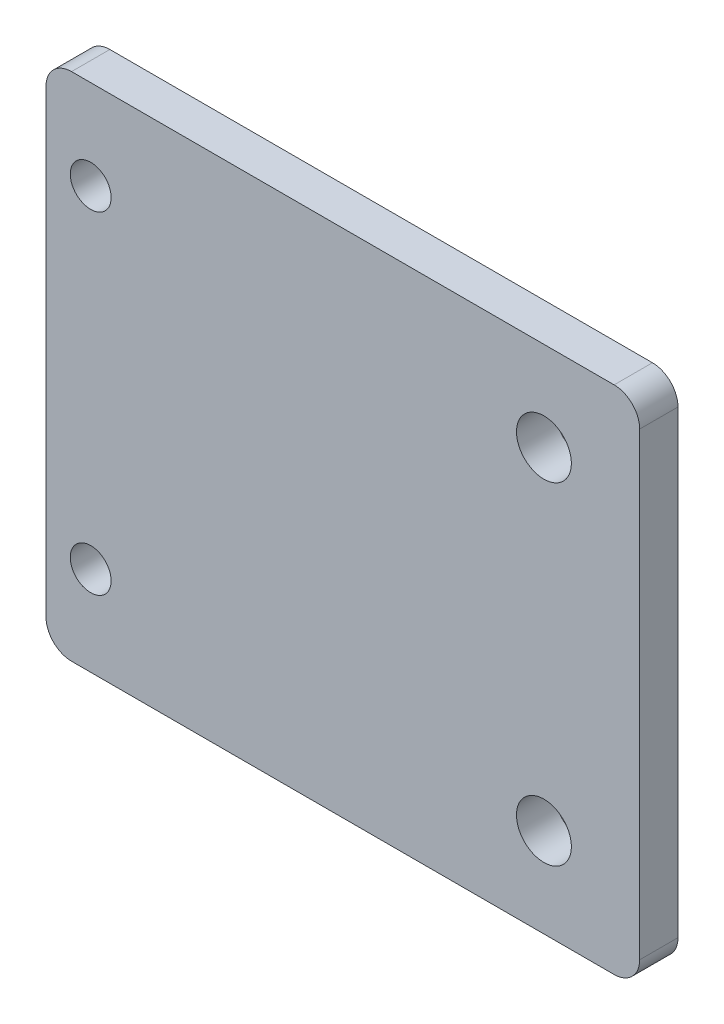
from build123d import *

# Parameters (mm, degrees)
SKETCH1_W                = 46.5
SKETCH1_H                = 40
BOSS_EXTRUDE1_DEPTH      = 3
M3_CLEARANCE_HOLE1_D     = 3.2
M3_CLEARANCE_HOLE1_DEPTH = 8
M3_CLEARANCE_HOLE1_TIP   = 0.96137699
M4_CLEARANCE_HOLE1_D     = 4.3
M4_CLEARANCE_HOLE1_DEPTH = 8
M4_CLEARANCE_HOLE1_TIP   = 1.291850331
FILLET1_R                = 2


with BuildPart() as part:
    # Sketch1 → Boss-Extrude1 (new body)
    with BuildSketch(Plane.XY):
        Rectangle(SKETCH1_W, SKETCH1_H)
    extrude(amount=BOSS_EXTRUDE1_DEPTH)

    # M3 Clearance Hole1
    with Locations(Plane.XY.offset(3)):
        with Locations((-19.75, 13), (-19.75, -13)):
            Hole(M3_CLEARANCE_HOLE1_D / 2, depth=M3_CLEARANCE_HOLE1_DEPTH)
            with Locations((0, 0, -(M3_CLEARANCE_HOLE1_DEPTH + M3_CLEARANCE_HOLE1_TIP / 2))):  # 118° drill point
                Cone(0, M3_CLEARANCE_HOLE1_D / 2, M3_CLEARANCE_HOLE1_TIP, mode=Mode.SUBTRACT)

    # M4 Clearance Hole1
    with Locations(Plane.XY.offset(3)):
        with Locations((15.75, 13), (15.75, -13)):
            Hole(M4_CLEARANCE_HOLE1_D / 2, depth=M4_CLEARANCE_HOLE1_DEPTH)
            with Locations((0, 0, -(M4_CLEARANCE_HOLE1_DEPTH + M4_CLEARANCE_HOLE1_TIP / 2))):  # 118° drill point
                Cone(0, M4_CLEARANCE_HOLE1_D / 2, M4_CLEARANCE_HOLE1_TIP, mode=Mode.SUBTRACT)

    # Fillet1
    fillet1_edges = [part.edges().sort_by_distance(p)[0] for p in [
        (-23.25, 20, 1.5),
        (23.25, 20, 1.5),
        (23.25, -20, 1.5),
        (-23.25, -20, 1.5),
    ]]
    fillet(fillet1_edges, radius=FILLET1_R)


solid = part.part
